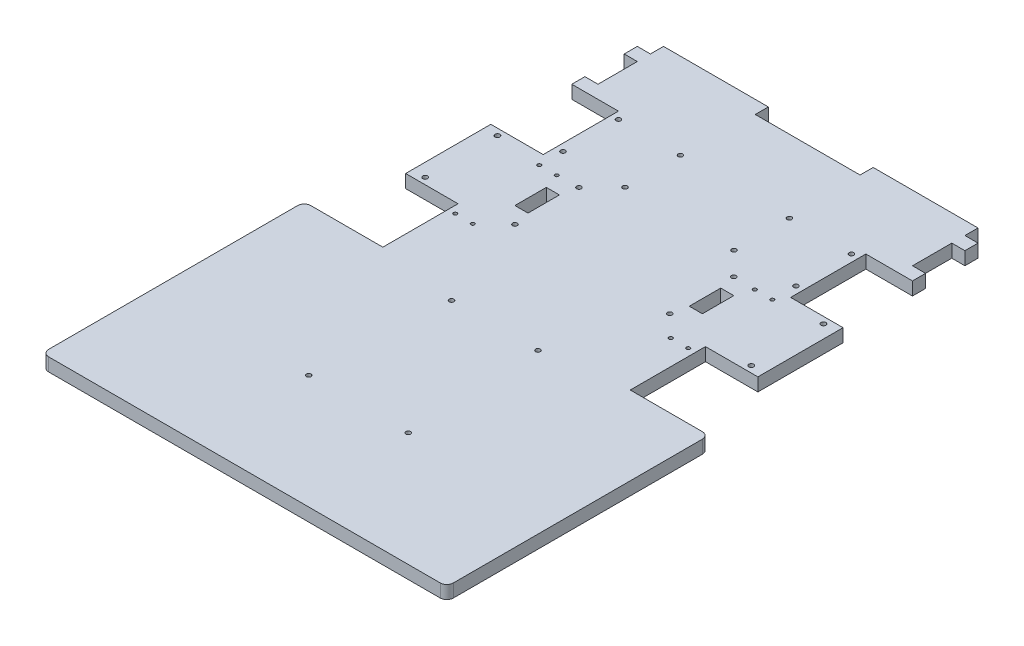
from build123d import *

# Parameters (mm, degrees)
SKETCH1_R           = 0.889
SKETCH1_R_2         = 1.1303
SKETCH1_W           = 6.35
SKETCH1_H           = 15.24
BOSS_EXTRUDE1_DEPTH = 6.35
SKETCH2_R           = 1.1684
CUT_EXTRUDE1_DEPTH  = 6.35


with BuildPart() as part:
    # Sketch1 → Boss-Extrude1 (new body)
    with BuildSketch(Plane(origin=(0, 0, 0), x_dir=(1, 0, 0), z_dir=(0, 1, 0))):
        with BuildLine():
            Line((-147.642205972, 18.314662121), (-147.642205972, -22.960337879))
            Line((-147.642205972, -22.960337879), (-122.242205972, -22.960337879))
            Line((-122.242205972, -22.960337879), (-122.242205972, -59.409337879))
            Line((-122.242205972, -59.409337879), (-157.167205972, -59.409337879))
            ThreePointArc((-157.167205972, -59.409337879), (-159.412270002, -60.339273849), (-160.342205972, -62.584337879))
            Line((-160.342205972, -62.584337879), (-160.342205972, -183.234337879))
            ThreePointArc((-160.342205972, -183.234337879), (-159.412270002, -185.479401909), (-157.167205972, -186.409337879))
            Line((-157.167205972, -186.409337879), (-62.292205972, -186.409337879))
            Line((-62.292205972, -186.409337879), (-62.292205972, 86.513662121))
            Line((-62.292205972, 86.513662121), (-87.692205972, 86.513662121))
            Line((-87.692205972, 86.513662121), (-87.692205972, 92.863662121))
            Line((-87.692205972, 92.863662121), (-138.492205972, 92.863662121))
            Line((-138.492205972, 92.863662121), (-138.492205972, 86.513662121))
            Line((-138.492205972, 86.513662121), (-144.842205972, 86.513662121))
            Line((-144.842205972, 86.513662121), (-144.842205972, 80.163662121))
            Line((-144.842205972, 80.163662121), (-138.492205972, 80.163662121))
            Line((-138.492205972, 80.163662121), (-138.492205972, 61.113662121))
            Line((-138.492205972, 61.113662121), (-144.842205972, 61.113662121))
            Line((-144.842205972, 61.113662121), (-144.842205972, 54.763662121))
            Line((-144.842205972, 54.763662121), (-122.242205972, 54.763662121))
            Line((-122.242205972, 54.763662121), (-122.242205972, 18.314662121))
            Line((-122.242205972, 18.314662121), (-147.642205972, 18.314662121))
        make_face()
        with Locations(Location((-118.749705972, -27.815337973, 0), (0, 0, 270))):
            Circle(SKETCH1_R, mode=Mode.SUBTRACT)
        with Locations(Location((-118.749705972, 12.919662091, 0), (0, 0, 270))):
            Circle(SKETCH1_R, mode=Mode.SUBTRACT)
        with Locations(Location((-110.264705924, 12.919662091, 0), (0, 0, 270))):
            Circle(SKETCH1_R, mode=Mode.SUBTRACT)
        with Locations(Location((-110.264705924, -27.815337973, 0), (0, 0, 270))):
            Circle(SKETCH1_R, mode=Mode.SUBTRACT)
        with Locations(Location((-118.749705972, 51.271162121, 0), (0, 0, 270))):
            Circle(SKETCH1_R_2, mode=Mode.SUBTRACT)
        with Locations(Location((-118.749705972, 24.397962121, 0), (0, 0, 270))):
            Circle(SKETCH1_R_2, mode=Mode.SUBTRACT)
        with Locations(Location((-88.701505972, 51.271162121, 0), (0, 0, 270))):
            Circle(SKETCH1_R_2, mode=Mode.SUBTRACT)
        with Locations(Location((-88.701505972, 24.397962121, 0), (0, 0, 270))):
            Circle(SKETCH1_R_2, mode=Mode.SUBTRACT)
        with Locations(Location((-99.792205972, 13.177162121, 0), (0, 0, 270))):
            Circle(SKETCH1_R_2, mode=Mode.SUBTRACT)
        with Locations(Location((-99.792205972, -17.822837879, 0), (0, 0, 270))):
            Circle(SKETCH1_R_2, mode=Mode.SUBTRACT)
        with Locations(Location((-83.247205972, -65.124337879, 0), (0, 0, 270))):
            Circle(SKETCH1_R_2, mode=Mode.SUBTRACT)
        with Locations(Location((-86.422205972, -131.164337879, 0), (0, 0, 270))):
            Circle(SKETCH1_R_2, mode=Mode.SUBTRACT)
        with Locations((-104.549705924, -2.322837879)):
            Rectangle(SKETCH1_W, SKETCH1_H, mode=Mode.SUBTRACT)
    boss_extrude1 = extrude(amount=BOSS_EXTRUDE1_DEPTH)

    # Sketch2 → Cut-Extrude1 (cut)
    with BuildSketch(Plane(origin=(0, 6.35, 0), x_dir=(1, 0, 0), z_dir=(0, 1, 0))):
        with Locations(Location((-141.292205972, 15.177162121, 0), (0, 0, 270))):
            Circle(SKETCH2_R)
        with Locations(Location((-141.292205972, -19.822837879, 0), (0, 0, 270))):
            Circle(SKETCH2_R)
    cut_extrude1 = extrude(amount=-CUT_EXTRUDE1_DEPTH, mode=Mode.SUBTRACT)

    # Mirror1: Boss-Extrude1, Cut-Extrude1 across plane
    add(boss_extrude1.mirror(Plane(origin=(-62.292205972, 6.35, -86.513662121), x_dir=(0, 0, 1), z_dir=(-1, 0, 0))))
    add(cut_extrude1.mirror(Plane(origin=(-62.292205972, 6.35, -86.513662121), x_dir=(0, 0, 1), z_dir=(-1, 0, 0))), mode=Mode.SUBTRACT)


solid = part.part
